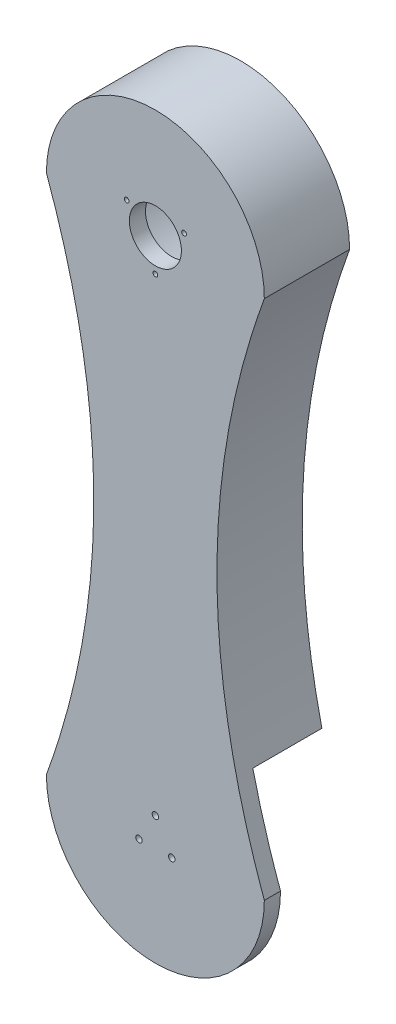
from build123d import *

# Parameters (mm, degrees)
BOSS_EXTRUDE1_DEPTH = 90
SKETCH2_R           = 97.5
CUT_EXTRUDE1_DEPTH  = 72.91
SKETCH6_R           = 97.5
CUT_EXTRUDE5_DEPTH  = 72.91
SKETCH7_R           = 27.5
CUT_EXTRUDE6_DEPTH  = 72.91
CUT_EXTRUDE10_DEPTH = 72.91
SKETCH13_R          = 3.4
CUT_EXTRUDE13_DEPTH = 17.09
SKETCH14_R          = 2.5
CUT_EXTRUDE14_DEPTH = 17.09
CIRPATTERN1_COUNT   = 3


with BuildPart() as part:
    # Sketch1 → Boss-Extrude1 (new body)
    with BuildSketch(Plane(origin=(0, 0, 0), x_dir=(0, 1, 0), z_dir=(0, 0, 1))):
        with BuildLine():
            ThreePointArc((0, 115), (-115, 0), (0, -115))
            add(Edge.make_bspline(
                [(0, -115), (275, -15), (550, -115)],
                knots=[0, 0, 0, 1, 1, 1], degree=2))
            ThreePointArc((550, -115), (665, 0), (550, 115))
            add(Edge.make_bspline(
                [(0, 115), (275, 15), (550, 115)],
                knots=[0, 0, 0, 1, 1, 1], degree=2))
        make_face()
    extrude(amount=BOSS_EXTRUDE1_DEPTH)

    # Sketch2 → Cut-Extrude1 (cut)
    with BuildSketch(Plane(origin=(0, 0, 0), x_dir=(1, 0, 0), z_dir=(0, 0, -1))):
        with Locations(Location((0, 0, 0), (0, 0, 180))):
            Circle(SKETCH2_R)
    extrude(amount=-CUT_EXTRUDE1_DEPTH, mode=Mode.SUBTRACT)

    # Sketch6 → Cut-Extrude5 (cut)
    with BuildSketch(Plane(origin=(0, 0, 0), x_dir=(1, 0, 0), z_dir=(0, 0, -1))):
        with Locations(Location((0, -550, 0), (0, 0, 180))):
            Circle(SKETCH6_R)
    extrude(amount=-CUT_EXTRUDE5_DEPTH, mode=Mode.SUBTRACT)

    # Sketch7 → Cut-Extrude6 (cut)
    with BuildSketch(Plane(origin=(0, 0, 72.91), x_dir=(1, 0, 0), z_dir=(0, 0, -1))):
        with Locations(Location((0, -550, 0), (0, 0, 180))):
            Circle(SKETCH7_R)
    extrude(amount=-CUT_EXTRUDE6_DEPTH, mode=Mode.SUBTRACT)

    # Sketch10 → Cut-Extrude10 (cut)
    with BuildSketch(Plane(origin=(0, 0, 0), x_dir=(1, 0, 0), z_dir=(0, 0, -1))):
        with BuildLine():
            ThreePointArc((115, 0), (0, 115), (-115, 0))
            add(Edge.make_bspline(
                [(-85.785633537, -97.691594321), (-97.237891942, -48.84579716), (-115, 0)],
                knots=[0, 0, 0, 1, 1, 1], degree=2))
            ThreePointArc((-85.785633537, -97.691594321), (0, -117.630315166), (85.785633537, -97.691594321))
            add(Edge.make_bspline(
                [(115, 0), (97.237891942, -48.84579716), (85.785633537, -97.691594321)],
                knots=[0, 0, 0, 1, 1, 1], degree=2))
        make_face()
    extrude(amount=-CUT_EXTRUDE10_DEPTH, mode=Mode.SUBTRACT)

    # Sketch13 → Cut-Extrude13 (cut)
    with BuildSketch(Plane(origin=(0, 0, 72.91), x_dir=(1, 0, 0), z_dir=(0, 0, -1))):
        with Locations(Location((0, -20, 0), (0, 0, 180))):
            Circle(SKETCH13_R)
        with Locations(Location((-17.320508076, 10, 0), (0, 0, 180))):
            Circle(SKETCH13_R)
        with Locations(Location((17.320508076, 10, 0), (0, 0, 180))):
            Circle(SKETCH13_R)
    extrude(amount=-CUT_EXTRUDE13_DEPTH, mode=Mode.SUBTRACT)

    # Sketch14 → Cut-Extrude14 (cut)
    with BuildSketch(Plane.XY.offset(90)):
        with Locations((0, 515)):
            Circle(SKETCH14_R)
    cut_extrude14 = extrude(amount=-CUT_EXTRUDE14_DEPTH, mode=Mode.SUBTRACT)

    # CirPattern1: Cut-Extrude14 ×3 about axis
    cirpattern1_axis = Axis((0, 550, 0), (0, 0, 1))
    for i in range(1, CIRPATTERN1_COUNT):
        add(cut_extrude14.rotate(cirpattern1_axis, i * 360 / CIRPATTERN1_COUNT), mode=Mode.SUBTRACT)


solid = part.part
